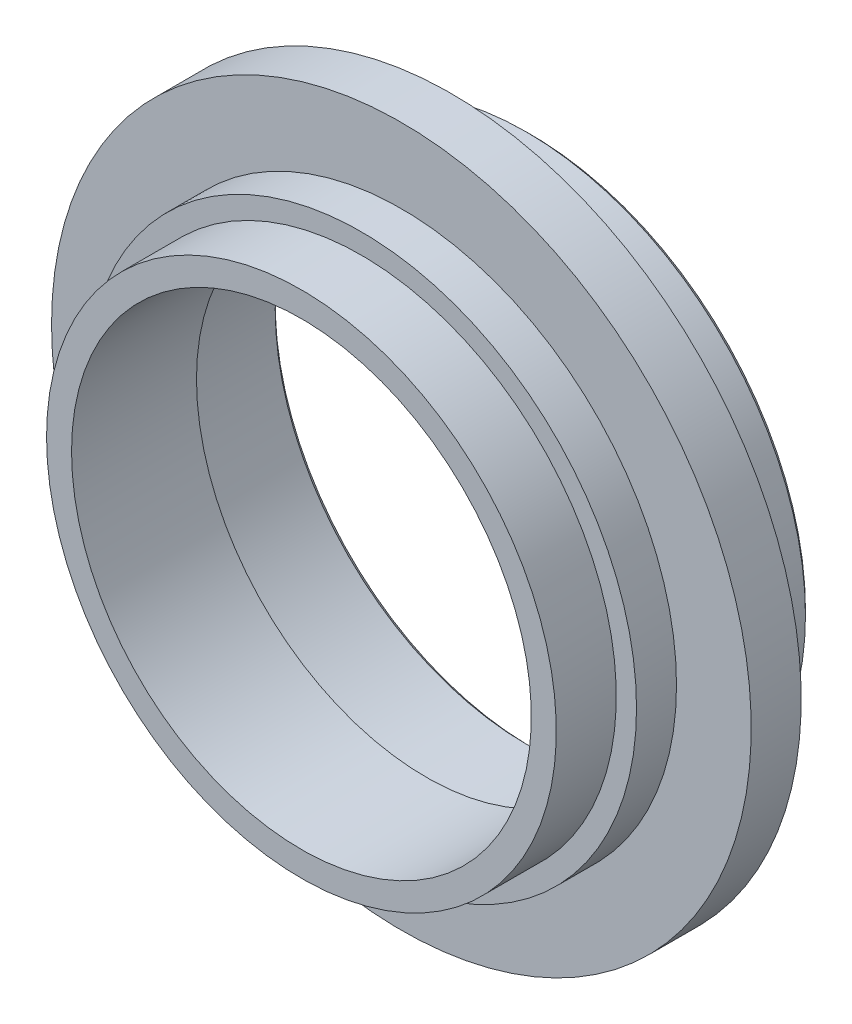
from build123d import *

# Parameters (mm, degrees)
CHAMFER1_SIZE = 0.5


with BuildPart() as part:
    # Sketch1 → Revolve1 (revolve)
    with BuildSketch(Plane(origin=(0, 0, 0), x_dir=(1, 0, 0), z_dir=(0, 1, 0)), mode=Mode.PRIVATE) as revolve1_sk:
        Polygon((25.125, 23), (27.925, 23), (27.925, 15), (35, 15), (35, 10), (27.525, 10), (27.525, 6), (25.5, 6), (25.5, 0), (23, 0), (23, 12.5), (25.125, 12.5), align=None)
    revolve(revolve1_sk.sketch.rotate(Axis((0, 0, -99.297916667), (0, 0, 1)), 180), axis=Axis((0, 0, -99.297916667), (0, 0, 1)))

    # Chamfer1
    chamfer1_edges = [part.edges().sort_by_distance(p)[0] for p in [
        (27.925, 0, -23),
        (25.125, 0, -23),
    ]]
    chamfer(chamfer1_edges, length=CHAMFER1_SIZE)


solid = part.part
